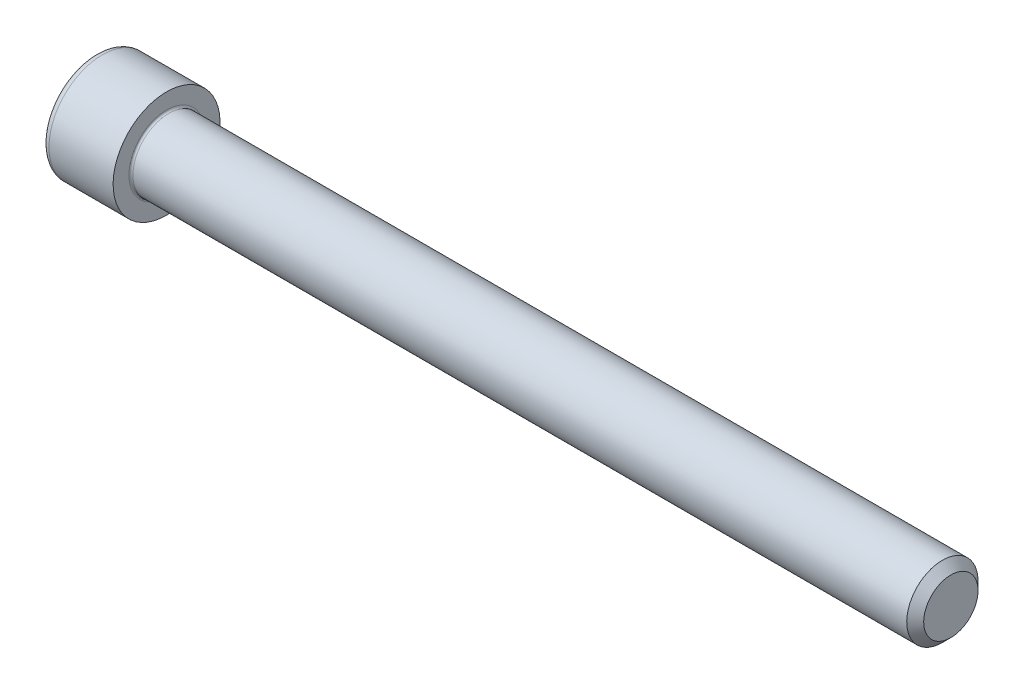
from build123d import *

# Parameters (mm, degrees)
SLOT_REACH    = 78.497
THREAD_R      = 0.635
CHAMFER1_SIZE = 0.75565
FILLET2_R     = 0.1778


with BuildPart() as part:
    # Sketch1 → Body (revolve)
    with BuildSketch(Plane.XY, mode=Mode.PRIVATE) as body_sk:
        Polygon((-1.710266667, 0), (69.85, 0), (69.85, 3.175), (38.1, 3.175), (34.9249, 3.175), (0, 3.175), (0, 4.7625), (-6.35, 4.7625), (-6.35, 2.756963005), (-3.302, 2.756963005), align=None)
    revolve(body_sk.sketch.rotate(Axis((-1.710266667, 0, 0), (1, 0, 0)), 180), axis=Axis((-1.710266667, 0, 0), (1, 0, 0)))

    # Slot: up to this cone (the profile starts inside it)
    slot_end = Plane(origin=(-6.35, 0, 0), z_dir=(-1, 0, 0)).offset(-4.639732333) * Cone(1.732e-06, 158.782271512, 91.6729862, align=(Align.CENTER, Align.CENTER, Align.MIN), mode=Mode.PRIVATE)
    # Sketch2 → Slot (add, up to the surface)
    with BuildSketch(Plane.ZY.offset(6.35), mode=Mode.PRIVATE) as slot_sk1:
        with BuildLine():
            ThreePointArc((1.378481503, -2.3876), (2.3876, -1.378481503), (2.756963005, 0))
            Line((2.756963005, 0), (1.378481503, -2.3876))
        make_face()
    slot_tool1 = extrude(slot_sk1.sketch, amount=-SLOT_REACH, mode=Mode.PRIVATE) & slot_end
    add(slot_tool1.solids().sort_by_distance((-6.35, -1.268114, 2.196438))[0])
    # Sketch2 → Slot (add, up to the surface)
    with BuildSketch(Plane.ZY.offset(6.35), mode=Mode.PRIVATE) as slot_sk2:
        with BuildLine():
            ThreePointArc((-1.378481503, -2.3876), (0, -2.756963005), (1.378481503, -2.3876))
            Line((1.378481503, -2.3876), (-1.378481503, -2.3876))
        make_face()
    slot_tool2 = extrude(slot_sk2.sketch, amount=-SLOT_REACH, mode=Mode.PRIVATE) & slot_end
    add(slot_tool2.solids().sort_by_distance((-6.35, -2.536228, 0))[0])
    # Sketch2 → Slot (add, up to the surface)
    with BuildSketch(Plane.ZY.offset(6.35), mode=Mode.PRIVATE) as slot_sk3:
        with BuildLine():
            ThreePointArc((-2.756963005, 0), (-2.3876, -1.378481503), (-1.378481503, -2.3876))
            Line((-1.378481503, -2.3876), (-2.756963005, 0))
        make_face()
    slot_tool3 = extrude(slot_sk3.sketch, amount=-SLOT_REACH, mode=Mode.PRIVATE) & slot_end
    add(slot_tool3.solids().sort_by_distance((-6.35, -1.268114, -2.196438))[0])
    # Sketch2 → Slot (add, up to the surface)
    with BuildSketch(Plane.ZY.offset(6.35), mode=Mode.PRIVATE) as slot_sk4:
        with BuildLine():
            Line((-2.756963005, 0), (-1.378481503, 2.3876))
            ThreePointArc((-1.378481503, 2.3876), (-2.3876, 1.378481503), (-2.756963005, 0))
        make_face()
    slot_tool4 = extrude(slot_sk4.sketch, amount=-SLOT_REACH, mode=Mode.PRIVATE) & slot_end
    add(slot_tool4.solids().sort_by_distance((-6.35, 1.268114, -2.196438))[0])
    # Sketch2 → Slot (add, up to the surface)
    with BuildSketch(Plane.ZY.offset(6.35), mode=Mode.PRIVATE) as slot_sk5:
        with BuildLine():
            Line((-1.378481503, 2.3876), (1.378481503, 2.3876))
            ThreePointArc((1.378481503, 2.3876), (0, 2.756963005), (-1.378481503, 2.3876))
        make_face()
    slot_tool5 = extrude(slot_sk5.sketch, amount=-SLOT_REACH, mode=Mode.PRIVATE) & slot_end
    add(slot_tool5.solids().sort_by_distance((-6.35, 2.536228, 0))[0])
    # Sketch2 → Slot (add, up to the surface)
    with BuildSketch(Plane.ZY.offset(6.35), mode=Mode.PRIVATE) as slot_sk6:
        with BuildLine():
            Line((1.378481503, 2.3876), (2.756963005, 0))
            ThreePointArc((2.756963005, 0), (2.3876, 1.378481503), (1.378481503, 2.3876))
        make_face()
    slot_tool6 = extrude(slot_sk6.sketch, amount=-SLOT_REACH, mode=Mode.PRIVATE) & slot_end
    add(slot_tool6.solids().sort_by_distance((-6.35, 1.268114, 2.196438))[0])

    # Thread
    thread_edges = [part.edges().sort_by_distance(p)[0] for p in [
        (-6.35, 4.7625, 0),
    ]]
    fillet(thread_edges, radius=THREAD_R)

    # Chamfer1
    chamfer1_edges = [part.edges().sort_by_distance(p)[0] for p in [
        (69.85, 3.175, 0),
    ]]
    chamfer(chamfer1_edges, length=CHAMFER1_SIZE)

    # Fillet2
    fillet2_edges = [part.edges().sort_by_distance(p)[0] for p in [
        (0, 3.175, 0),
    ]]
    fillet(fillet2_edges, radius=FILLET2_R)


solid = part.part
